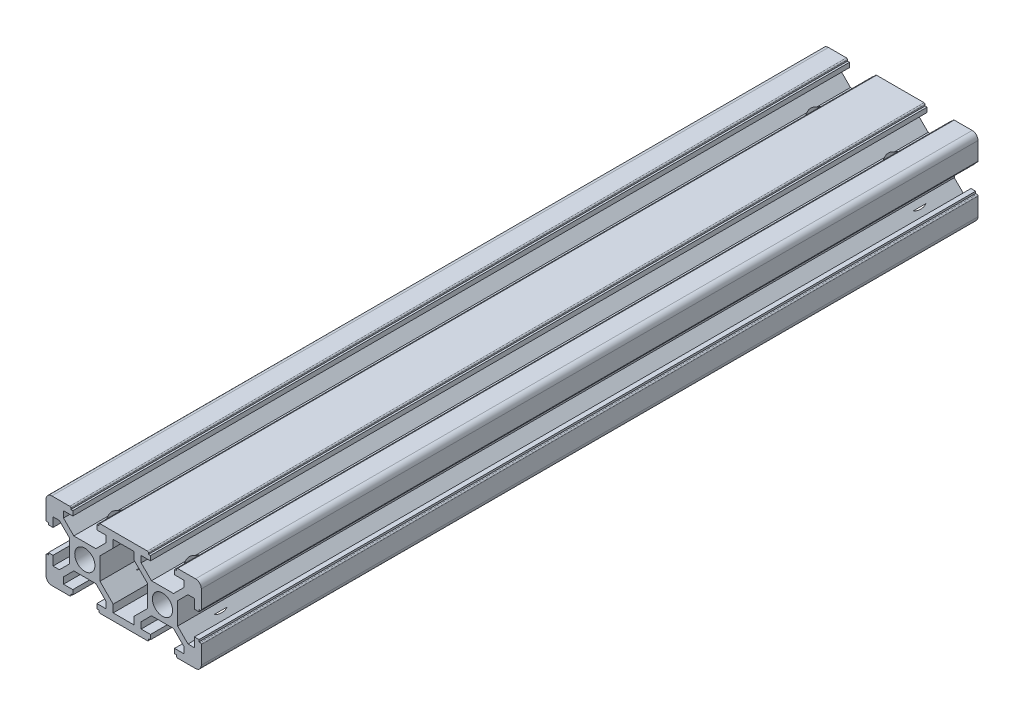
from build123d import *

# Parameters (mm, degrees)
SKETCH_1_R               = 2.6
EXTRUDE_1_DEPTH          = 100
FILLET_1_R               = 1.5
FILLET_2_R               = 0.3
CUT_EXTRUDE_1_DEPTH      = 103.923320972
CUT_EXTRUDE_1_DEPTH_BACK = 103.923320972
SKETCH_3_R               = 3.1
SKETCH_5_R               = 5.25
CUT_EXTRUDE_3_DEPTH      = 103.92332107


with BuildPart() as part:
    # 草图1 → 凸台-拉伸1 (new, symmetric)
    with BuildSketch(Plane.XY):
        Polygon((-13.9, 0), (-13.9, 2.839339828), (-16.560660172, 5.5), (-18.2, 5.5), (-18.2, 3.1), (-19.4, 3.1), (-19.4, 3.6), (-20, 3.6), (-20, 10), (-13.6, 10), (-13.6, 9.4), (-13.1, 9.4), (-13.1, 8.2), (-15.5, 8.2), (-15.5, 6.560660172), (-12.839339828, 3.9), (-7.160660172, 3.9), (-4.5, 6.560660172), (-4.5, 8.2), (-6.9, 8.2), (-6.9, 9.4), (-6.4, 9.4), (-6.4, 10), (6.4, 10), (6.4, 9.4), (6.9, 9.4), (6.9, 8.2), (4.5, 8.2), (4.5, 6.560660172), (7.160660172, 3.9), (12.839339828, 3.9), (15.5, 6.560660172), (15.5, 8.2), (13.1, 8.2), (13.1, 9.4), (13.6, 9.4), (13.6, 10), (20, 10), (20, 3.6), (19.4, 3.6), (19.4, 3.1), (18.2, 3.1), (18.2, 5.5), (16.560660172, 5.5), (13.9, 2.839339828), (13.9, 0), (13.9, -2.839339828), (16.560660172, -5.5), (18.2, -5.5), (18.2, -3.1), (19.4, -3.1), (19.4, -3.6), (20, -3.6), (20, -10), (13.6, -10), (13.6, -9.4), (13.1, -9.4), (13.1, -8.2), (15.5, -8.2), (15.5, -6.560660172), (12.839339828, -3.9), (7.160660172, -3.9), (4.5, -6.560660172), (4.5, -8.2), (6.9, -8.2), (6.9, -9.4), (6.4, -9.4), (6.4, -10), (-6.4, -10), (-6.4, -9.4), (-6.9, -9.4), (-6.9, -8.2), (-4.5, -8.2), (-4.5, -6.560660172), (-7.160660172, -3.9), (-12.839339828, -3.9), (-15.5, -6.560660172), (-15.5, -8.2), (-13.1, -8.2), (-13.1, -9.4), (-13.6, -9.4), (-13.6, -10), (-20, -10), (-20, -3.6), (-19.4, -3.6), (-19.4, -3.1), (-18.2, -3.1), (-18.2, -5.5), (-16.560660172, -5.5), (-13.9, -2.839339828), align=None)
        with Locations((-10, 0)):
            Circle(SKETCH_1_R, mode=Mode.SUBTRACT)
        with Locations(Location((10, 0, 0), (0, 0, 180))):
            Circle(SKETCH_1_R, mode=Mode.SUBTRACT)
        Polygon((-6.1, -2.839339828), (-6.1, 2.839339828), (-2.7, 6.239339828), (-2.7, 8.2), (2.7, 8.2), (2.7, 6.239339828), (6.1, 2.839339828), (6.1, -2.839339828), (2.7, -6.239339828), (2.7, -8.2), (-2.7, -8.2), (-2.7, -6.239339828), align=None, mode=Mode.SUBTRACT)
    extrude(amount=EXTRUDE_1_DEPTH, both=True)

    # 圆角1
    fillet_1_edges = [part.edges().sort_by_distance(p)[0] for p in [
        (-20, 10, 0),
        (20, 10, 0),
        (20, -10, 0),
        (-20, -10, 0),
    ]]
    fillet(fillet_1_edges, radius=FILLET_1_R)

    # 圆角2
    fillet_2_edges = [part.edges().sort_by_distance(p)[0] for p in [
        (-20, 3.6, 0),
        (-13.6, 10, 0),
        (-6.4, 10, 0),
        (6.4, 10, 0),
        (13.6, 10, 0),
        (20, 3.6, 0),
        (20, -3.6, 0),
        (13.6, -10, 0),
        (6.4, -10, 0),
        (-6.4, -10, 0),
        (-13.6, -10, 0),
        (-20, -3.6, 0),
    ]]
    fillet(fillet_2_edges, radius=FILLET_2_R)

    # 草图3 → 切除-拉伸1 (cut, two sides: drawn at the far end of the back side and taken through both)
    with BuildSketch(Plane.XZ.offset(3.9).offset(-CUT_EXTRUDE_1_DEPTH_BACK)):
        with Locations(Location((10, -90, 0), (0, 0, 203.663841572))):
            Circle(SKETCH_3_R)
        with Locations(Location((-10, -90, 0), (0, 0, 336.336158428))):
            Circle(SKETCH_3_R)
        with Locations(Location((10, 90, 0), (0, 0, 203.663841572))):
            Circle(SKETCH_3_R)
        with Locations(Location((-10, 90, 0), (0, 0, 336.336158428))):
            Circle(SKETCH_3_R)
    extrude(amount=CUT_EXTRUDE_1_DEPTH + CUT_EXTRUDE_1_DEPTH_BACK, mode=Mode.SUBTRACT)

    # 草图5 → 切除-拉伸3 (cut, through all)
    with BuildSketch(Plane.XZ.offset(3.9)):
        with Locations((10, -90)):
            Circle(SKETCH_5_R)
        with Locations((-10, -90)):
            Circle(SKETCH_5_R)
        with Locations((10, 90)):
            Circle(SKETCH_5_R)
        with Locations((-10, 90)):
            Circle(SKETCH_5_R)
    extrude(amount=CUT_EXTRUDE_3_DEPTH, mode=Mode.SUBTRACT)


solid = part.part
